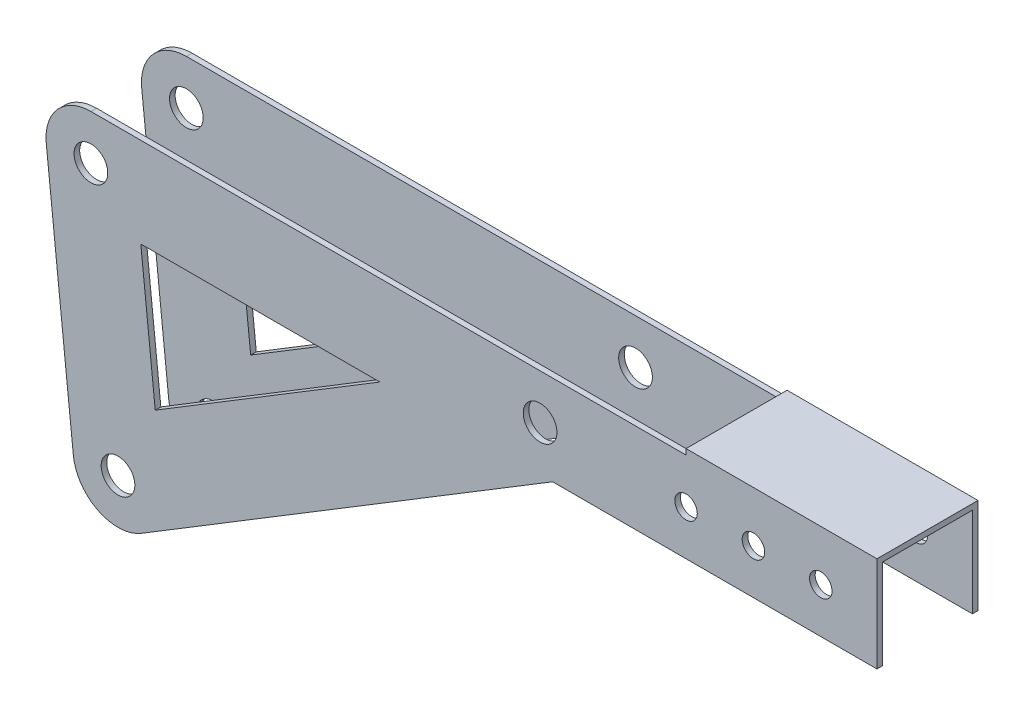
from build123d import *

# Parameters (mm, degrees)
SKETCH_1_R      = 1.5
SKETCH_1_R_2    = 1
EXTRUDE_1_DEPTH = 0.5
SKETCH_2_R      = 1.5
SKETCH_2_R_2    = 1
EXTRUDE_2_DEPTH = 0.5
SKETCH_3_W      = 17
SKETCH_3_H      = 9
EXTRUDE_3_DEPTH = 0.5


with BuildPart() as part:
    # 草图1 → 凸台-拉伸1 (new body)
    with BuildSketch(Plane.XY):
        with BuildLine():
            Line((-6.593488685, 7.462066188), (63.406511315, 7.462066188))
            Line((63.406511315, 7.462066188), (63.406511315, -0.537933812))
            Line((63.406511315, -0.537933812), (34.527914712, -0.537933812))
            Line((34.527914712, -0.537933812), (-2.101613692, -22.82810419))
            ThreePointArc((-2.101613692, -22.82810419), (-5.955067108, -22.996117417), (-8.158923454, -19.830623953))
            Line((-8.158923454, -19.830623953), (-10.571423454, 3.04250097))
            ThreePointArc((-10.571423454, 3.04250097), (-9.566556198, 6.138046301), (-6.593488685, 7.462066188))
        make_face()
        with Locations((-6.593488685, 3.462066188)):
            Circle(SKETCH_1_R, mode=Mode.SUBTRACT)
        with Locations((33.406511315, 3.462066188)):
            Circle(SKETCH_1_R, mode=Mode.SUBTRACT)
        with Locations((-4.180988685, -19.411058735)):
            Circle(SKETCH_1_R, mode=Mode.SUBTRACT)
        with Locations((58.406511315, 3.462066188)):
            Circle(SKETCH_1_R_2, mode=Mode.SUBTRACT)
        with Locations((52.406511315, 3.462066188)):
            Circle(SKETCH_1_R_2, mode=Mode.SUBTRACT)
        with Locations((46.406511315, 3.462066188)):
            Circle(SKETCH_1_R_2, mode=Mode.SUBTRACT)
        Polygon((-2.149408554, -0.537933812), (19.138675105, -0.537933812), (-0.865471009, -12.711058735), align=None, mode=Mode.SUBTRACT)
    extrude(amount=EXTRUDE_1_DEPTH)



with BuildPart() as body_2:
    # 草图2 → 凸台-拉伸2 (new body)
    with BuildSketch(Plane.XY.offset(-8)):
        with BuildLine():
            Line((-2.101613692, -22.82810419), (34.527914712, -0.537933812))
            Line((34.527914712, -0.537933812), (63.406511315, -0.537933812))
            Line((63.406511315, -0.537933812), (63.406511315, 7.462066188))
            Line((63.406511315, 7.462066188), (-6.593488685, 7.462066188))
            ThreePointArc((-6.593488685, 7.462066188), (-9.566556198, 6.138046301), (-10.571423454, 3.04250097))
            Line((-10.571423454, 3.04250097), (-8.158923454, -19.830623953))
            ThreePointArc((-8.158923454, -19.830623953), (-5.955067108, -22.996117417), (-2.101613692, -22.82810419))
        make_face()
        with Locations((-4.180988685, -19.411058735)):
            Circle(SKETCH_2_R, mode=Mode.SUBTRACT)
        with Locations((33.406511315, 3.462066188)):
            Circle(SKETCH_2_R, mode=Mode.SUBTRACT)
        with Locations((-6.593488685, 3.462066188)):
            Circle(SKETCH_2_R, mode=Mode.SUBTRACT)
        with Locations((52.406511315, 3.462066188)):
            Circle(SKETCH_2_R_2, mode=Mode.SUBTRACT)
        with Locations((58.406511315, 3.462066188)):
            Circle(SKETCH_2_R_2, mode=Mode.SUBTRACT)
        with Locations((46.406511315, 3.462066188)):
            Circle(SKETCH_2_R_2, mode=Mode.SUBTRACT)
        Polygon((-0.865471009, -12.711058735), (19.138675105, -0.537933812), (-2.149408554, -0.537933812), align=None, mode=Mode.SUBTRACT)
    extrude(amount=-EXTRUDE_2_DEPTH)


with BuildPart() as part_1:
    add(part.part)

    add(body_2.part)  # 凸台-拉伸3 merges body 2
    # 草图3 → 凸台-拉伸3 (add)
    with BuildSketch(Plane(origin=(0, 7.462066188, 0), x_dir=(1, 0, 0), z_dir=(0, 1, 0))):
        with Locations((54.906511315, 4)):
            Rectangle(SKETCH_3_W, SKETCH_3_H)
    extrude(amount=EXTRUDE_3_DEPTH)


solid = part_1.part
